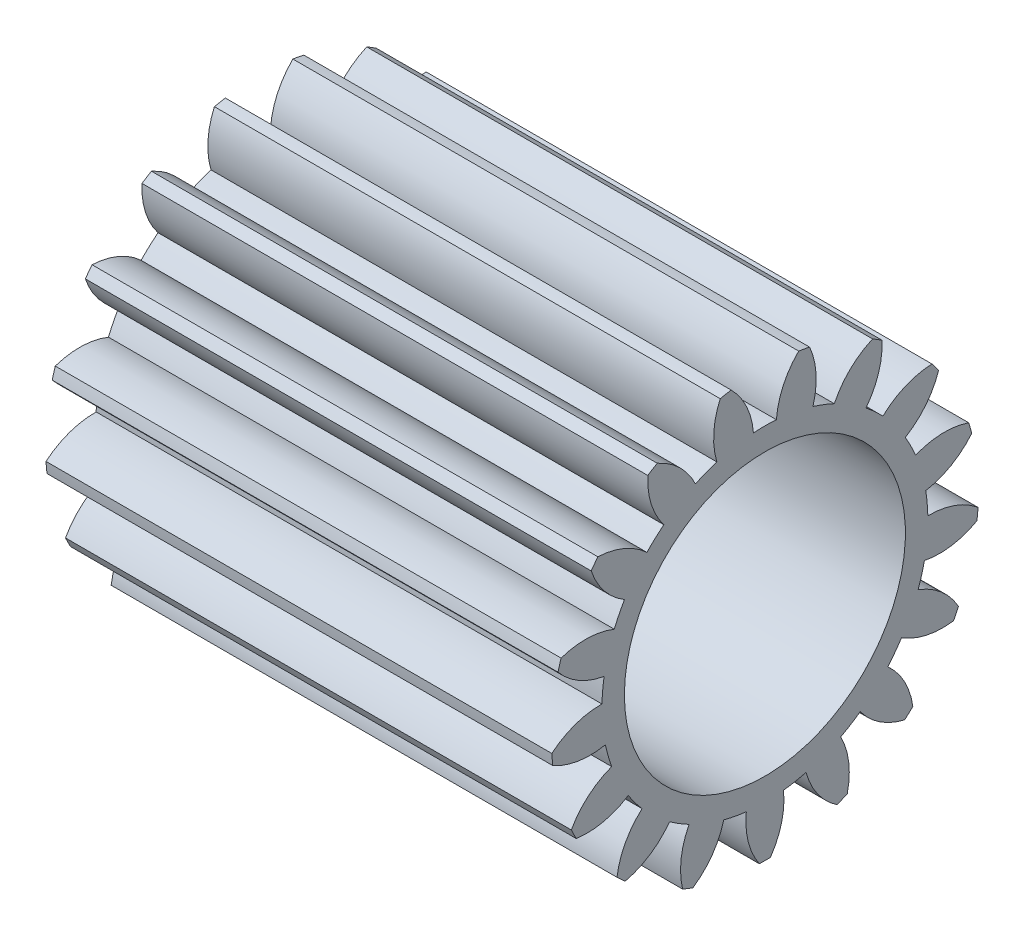
from build123d import *

# Parameters (mm, degrees)
BASPROSKE_W     = 45
BASPROSKE_H     = 19
TOOTHCUT_DEPTH  = 53.411830726
TEETHCUTS_COUNT = 17
TEETHCUTS_ANGLE = 338.823529412
BORSKE_R        = 12.5
BORE_DEPTH      = 50.0000508


with BuildPart() as part:
    # BasProSke → Base-Revolve (revolve)
    with BuildSketch(Plane(origin=(0, 0, 0), x_dir=(1, 0, 0), z_dir=(0, 1, 0)), mode=Mode.PRIVATE) as base_revolve_sk:
        with Locations((22.5, 9.5)):
            Rectangle(BASPROSKE_W, BASPROSKE_H)
    revolve(base_revolve_sk.sketch.rotate(Axis((-10, 0, 0), (1, 0, 0)), 180), axis=Axis((-10, 0, 0), (1, 0, 0)))

    # TooCutSke → ToothCut (cut, through all)
    with BuildSketch(Plane(origin=(0, 0, 0), x_dir=(0, 0, -1), z_dir=(1, 0, 0))):
        with BuildLine():
            ThreePointArc((1.020352389, 14.463052306), (0, 14.499), (-1.020352389, 14.463052306))
            ThreePointArc((-1.020352389, 14.463052306), (-1.632621885, 16.804485203), (-3.026143023, 18.783192049))
            ThreePointArc((-3.026143023, 18.783192049), (0, 19.0254), (3.026143023, 18.783192049))
            ThreePointArc((3.026143023, 18.783192049), (1.632621885, 16.804485203), (1.020352389, 14.463052306))
        make_face()
    toothcut = extrude(amount=TOOTHCUT_DEPTH, mode=Mode.SUBTRACT)

    # TeethCuts: ToothCut ×17 about axis
    teethcuts_axis = Axis((-10, 0, 0), (1, 0, 0))
    for i in range(1, TEETHCUTS_COUNT):
        add(toothcut.rotate(teethcuts_axis, i * TEETHCUTS_ANGLE / (TEETHCUTS_COUNT - 1)), mode=Mode.SUBTRACT)

    # BorSke → Bore (cut, symmetric)
    with BuildSketch(Plane(origin=(0, 0, 0), x_dir=(0, 0, -1), z_dir=(1, 0, 0))):
        with Locations(Location((0, 0, 0), (0, 0, 180))):
            Circle(BORSKE_R)
    extrude(amount=BORE_DEPTH, both=True, mode=Mode.SUBTRACT)


solid = part.part
